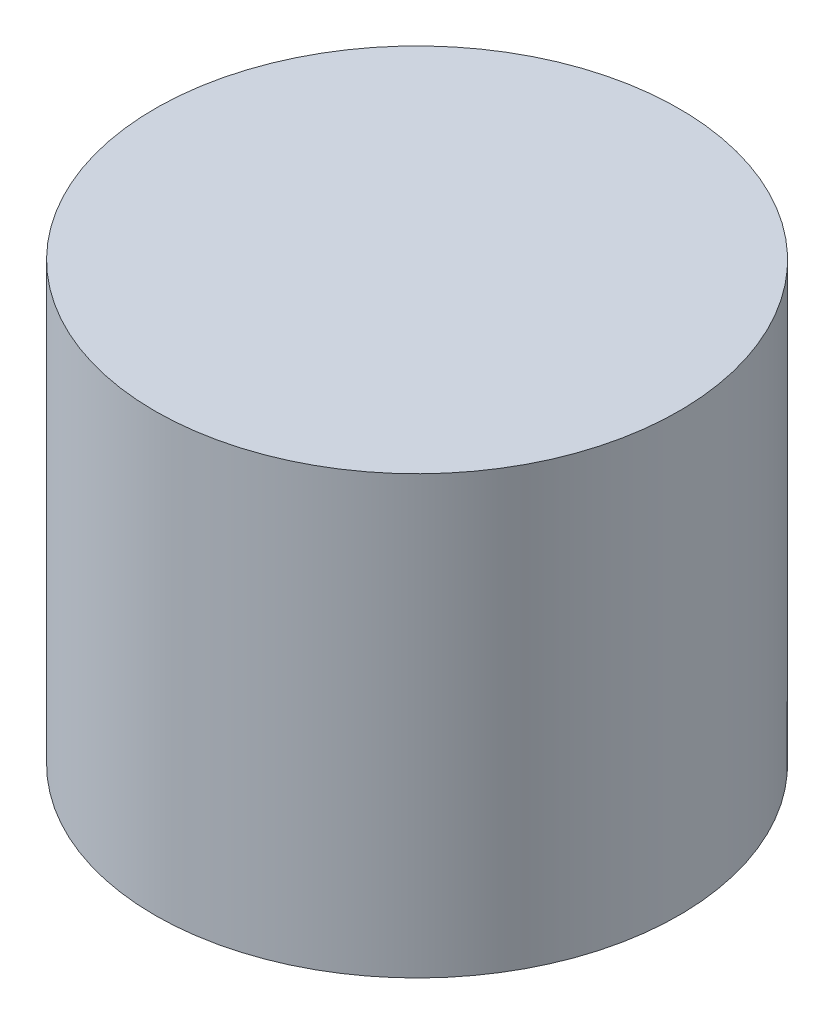
from build123d import *

# Parameters (mm, degrees)
SKETCH1_R           = 90
BOSS_EXTRUDE1_DEPTH = 150
SHELL1_T            = 12


with BuildPart() as part:
    # Sketch1 → Boss-Extrude1 (new body)
    with BuildSketch(Plane(origin=(0, 0, 0), x_dir=(1, 0, 0), z_dir=(0, 1, 0))):
        with Locations(Location((0, 0, 0), (0, 0, 270))):
            Circle(SKETCH1_R)
    extrude(amount=BOSS_EXTRUDE1_DEPTH)

    # Shell1 (no face opened: a closed hollow body)
    add(offset(amount=-SHELL1_T, mode=Mode.PRIVATE), mode=Mode.SUBTRACT)


solid = part.part
